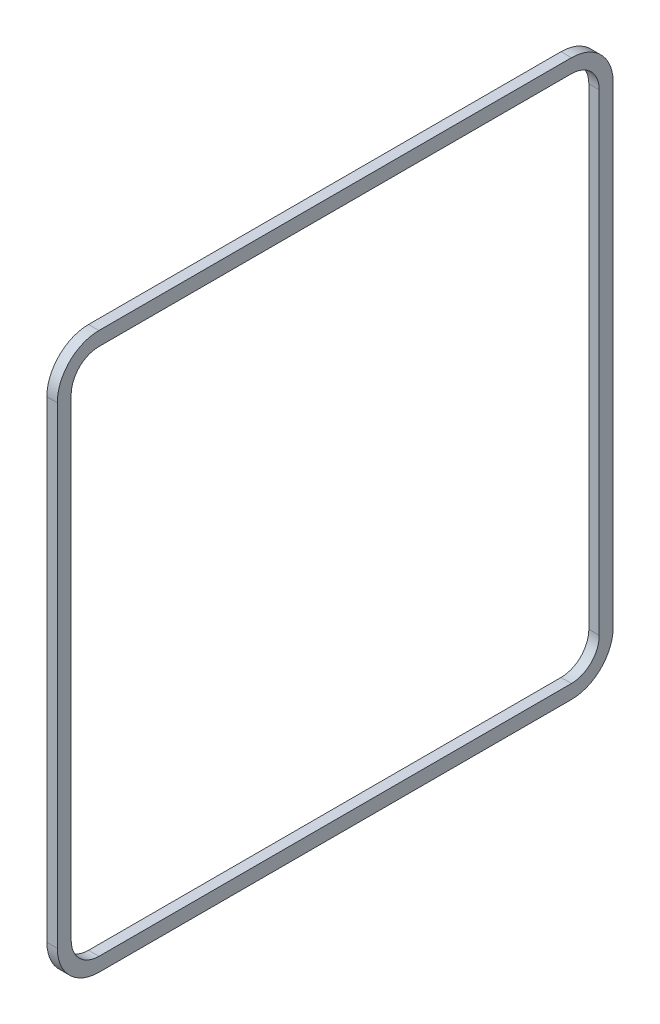
from build123d import *

# Parameters (mm, degrees)
BOSS_EXTRUDE1_DEPTH = 1.5


with BuildPart() as part:
    # Sketch1 → Boss-Extrude1 (new body)
    with BuildSketch(Plane(origin=(0, 0, 0), x_dir=(0, 0, -1), z_dir=(1, 0, 0))):
        with BuildLine():
            Line((34, -40), (-34, -40))
            ThreePointArc((-34, -40), (-38.242640687, -38.242640687), (-40, -34))
            Line((-40, -34), (-40, 34))
            ThreePointArc((-40, 34), (-38.242640687, 38.242640687), (-34, 40))
            Line((-34, 40), (34, 40))
            ThreePointArc((34, 40), (38.242640687, 38.242640687), (40, 34))
            Line((40, 34), (40, -34))
            ThreePointArc((40, -34), (38.242640687, -38.242640687), (34, -40))
        make_face()
        with BuildLine():
            Line((34, 38), (-34, 38))
            ThreePointArc((-34, 38), (-36.828427125, 36.828427125), (-38, 34))
            Line((-38, 34), (-38, -34))
            ThreePointArc((-38, -34), (-36.828427125, -36.828427125), (-34, -38))
            Line((-34, -38), (34, -38))
            ThreePointArc((34, -38), (36.828427125, -36.828427125), (38, -34))
            Line((38, -34), (38, 34))
            ThreePointArc((38, 34), (36.828427125, 36.828427125), (34, 38))
        make_face(mode=Mode.SUBTRACT)
    extrude(amount=BOSS_EXTRUDE1_DEPTH)


solid = part.part
